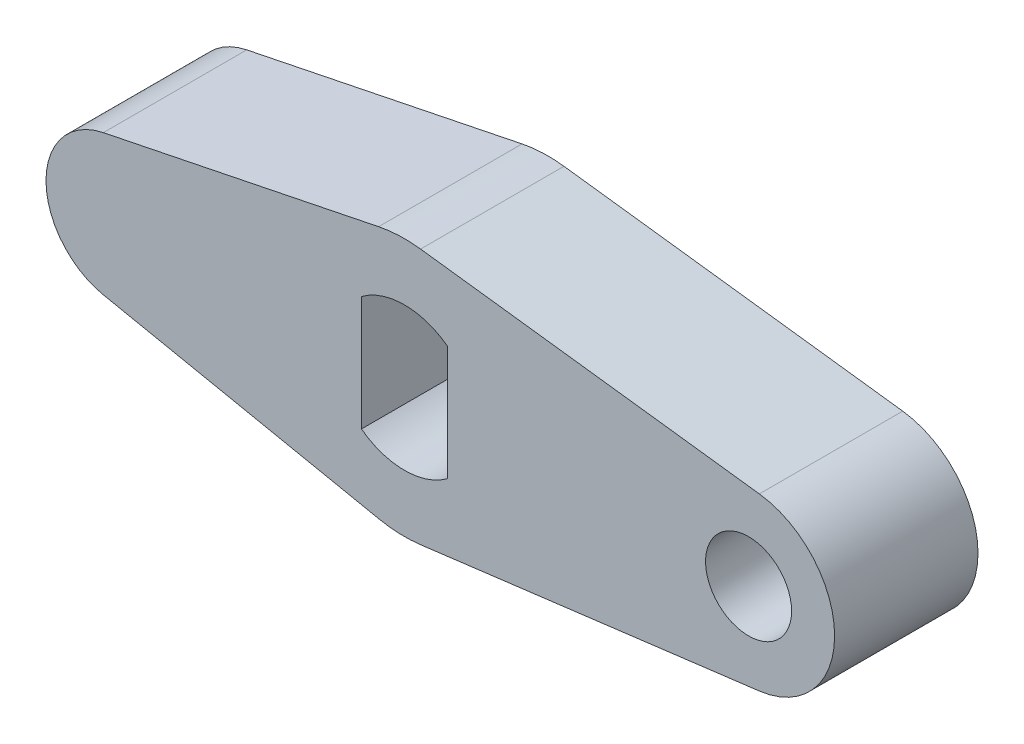
from build123d import *

# Parameters (mm, degrees)
SKETCH_1_R      = 2.5
SKETCH_1_R_2    = 4.5
SKETCH_1_R_3    = 3
SKETCH_1_R_4    = 1.5
EXTRUDE_1_DEPTH = 2.5


with BuildPart() as part:
    # Эскиз1 → Бобышка-Вытянуть1 (new, symmetric)
    # profile 1 of 7: a face of its own
    with BuildSketch(Plane.XY):
        with BuildLine():
            ThreePointArc((-0.9, -4.409081537), (-4.5, 0), (-0.9, 4.409081537))
            Line((-0.9, 4.409081537), (-10.5, 2.449489743))
            ThreePointArc((-10.5, 2.449489743), (-8.41886117, 1.936491673), (-7.5, 0))
            ThreePointArc((-7.5, 0), (-8.41886117, -1.936491673), (-10.5, -2.449489743))
            Line((-10.5, -2.449489743), (-0.9, -4.409081537))
        make_face()
    # profile 2 of 7: a face of its own
    with BuildSketch(Plane.XY):
        with Locations((-10, 0)):
            Circle(SKETCH_1_R)
    # profile 3 of 7: a face of its own
    with BuildSketch(Plane.XY):
        Circle(SKETCH_1_R_2)
        Circle(SKETCH_1_R, mode=Mode.SUBTRACT)
    # profile 4 of 7: a face of its own
    with BuildSketch(Plane.XY):
        with BuildLine():
            Line((12.375, 2.976470225), (0.5625, 4.464705337))
            ThreePointArc((0.5625, 4.464705337), (3.375, 2.976470225), (4.5, 0))
            ThreePointArc((4.5, 0), (3.375, -2.976470225), (0.5625, -4.464705337))
            Line((0.5625, -4.464705337), (12.375, -2.976470225))
            ThreePointArc((12.375, -2.976470225), (9, 0), (12.375, 2.976470225))
        make_face()
    # profile 5 of 7: a face of its own
    with BuildSketch(Plane.XY):
        with Locations((12, 0)):
            Circle(SKETCH_1_R_3)
        with Locations((12, 0)):
            Circle(SKETCH_1_R_4, mode=Mode.SUBTRACT)
    # profile 6 of 7: a face of its own
    with BuildSketch(Plane.XY):
        with BuildLine():
            Line((-1.5, -2), (-1.5, 2))
            ThreePointArc((-1.5, 2), (-2.5, 0), (-1.5, -2))
        make_face()
    # profile 7 of 7: a face of its own
    with BuildSketch(Plane.XY):
        with BuildLine():
            ThreePointArc((2.5, 0), (2.236067977, 1.118033989), (1.5, 2))
            Line((1.5, 2), (1.5, -2))
            ThreePointArc((1.5, -2), (2.236067977, -1.118033989), (2.5, 0))
        make_face()
    extrude(amount=EXTRUDE_1_DEPTH, both=True)


solid = part.part
